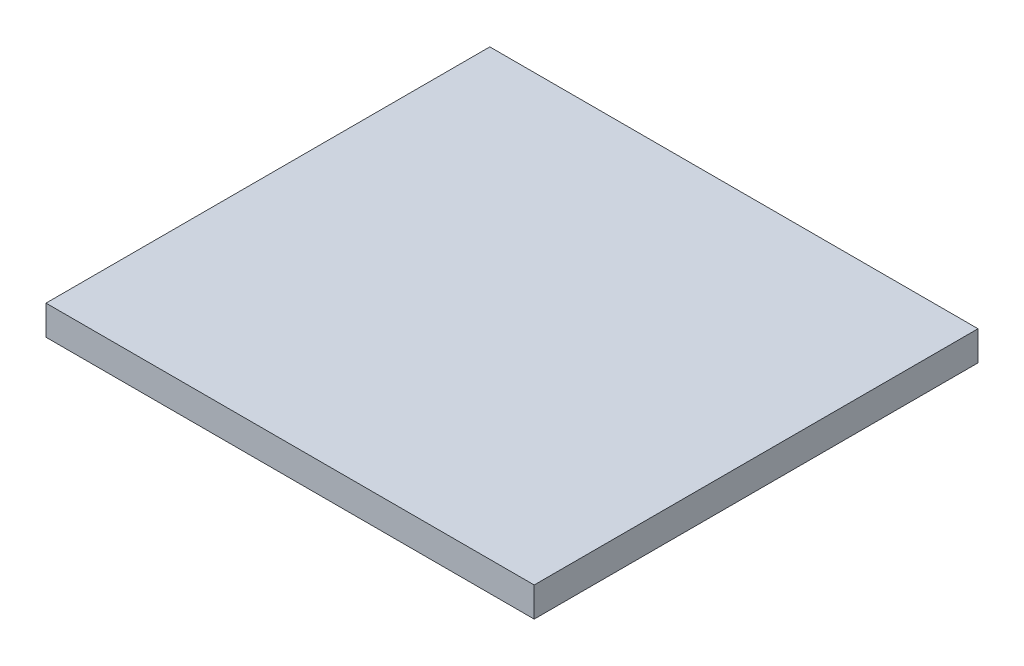
from build123d import *

# Parameters (mm, degrees)
SKETCH1_W           = 165
SKETCH1_H           = 150
BOSS_EXTRUDE1_DEPTH = 5


with BuildPart() as part:
    # Sketch1 → Boss-Extrude1 (new, symmetric)
    with BuildSketch(Plane(origin=(0, 0, 0), x_dir=(1, 0, 0), z_dir=(0, 1, 0))):
        Rectangle(SKETCH1_W, SKETCH1_H)
    extrude(amount=BOSS_EXTRUDE1_DEPTH, both=True)


solid = part.part
